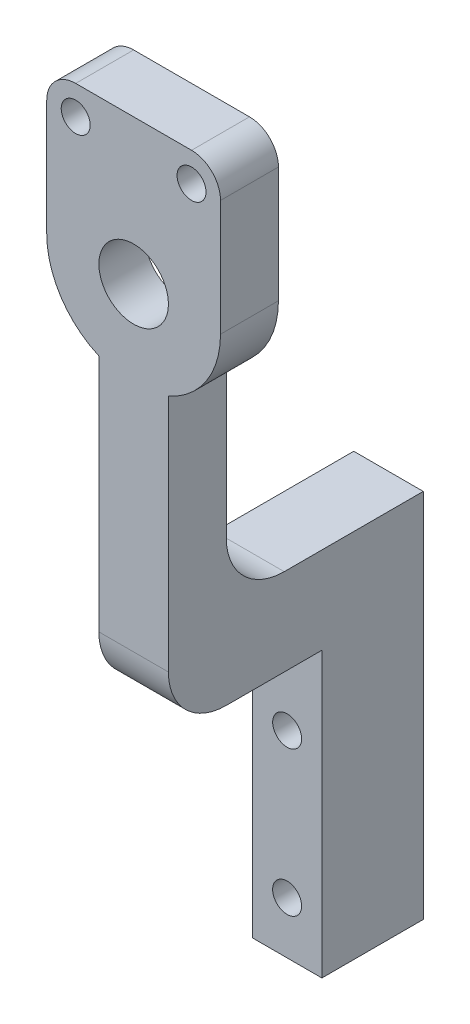
from build123d import *

# Parameters (mm, degrees)
SKETCH_1_R               = 5
EXTRUDE_1_DEPTH          = 12.5
SKETCH_2_R               = 6
EXTRUDE_2_DEPTH          = 22.5
SKETCH_3_R               = 5
EXTRUDE_3_DEPTH          = 12.5
SKETCH_4_W               = 12
SKETCH_4_H               = 35
EXTRUDE_4_DEPTH          = 80
EXTRUDE_5_DEPTH          = 12
EXTRUDE_6_DEPTH          = 10
SKETCH_7_R               = 9.5
CUT_EXTRUDE_1_DEPTH      = 2
SKETCH_8_R               = 6
CUT_EXTRUDE_2_DEPTH      = 166.329973084
EXTRUDE_START            = -10
EXTRUDE_7_DEPTH          = 10
SKETCH_10_R              = 2.5
CUT_EXTRUDE_3_DEPTH      = 10
FILLET_1_R               = 5
FILLET_2_R               = 5
SKETCH_11_R              = 2.5
CUT_EXTRUDE_4_DEPTH      = 10
EXTRUDE_8_DEPTH          = 10
SKETCH_13_R              = 12.5
SKETCH_13_R_2            = 2
CUT_EXTRUDE_5_DEPTH      = 10
PATTERN_CIRCULAR_1_COUNT = 8
SKETCH_14_R              = 2.5
EXTRUDE_9_DEPTH          = 10
SKETCH_15_R              = 2.5
CUT_EXTRUDE_6_DEPTH      = 35
CUT_EXTRUDE_7_DEPTH      = 175.719754648
CUT_EXTRUDE_8_DEPTH      = 1
CUT_EXTRUDE_8_DEPTH_BACK = 162.449682564
SKETCH_18_W              = 84.288718948
SKETCH_18_H              = 107.811152142


with BuildPart() as part:
    # 草图1 → 凸台-拉伸1 (new body)
    with BuildSketch(Plane.XY):
        Circle(SKETCH_1_R)
    extrude(amount=EXTRUDE_1_DEPTH)

    # 草图2 → 凸台-拉伸2 (add)
    with BuildSketch(Plane.XY.offset(12.5)):
        with Locations(Location((0, 0, 0), (0, 0, 180))):
            Circle(SKETCH_2_R)
    extrude_2 = extrude(amount=EXTRUDE_2_DEPTH)

    # 镜向2: 凸台-拉伸2 across plane
    add(extrude_2.mirror(Plane.XY.offset(35)))

    # 草图3 → 凸台-拉伸3 (add)
    with BuildSketch(Plane.XY.offset(57.5)):
        Circle(SKETCH_3_R)
    extrude(amount=EXTRUDE_3_DEPTH)

    # 草图4 → 凸台-拉伸4 (add)
    with BuildSketch(Plane(origin=(0, 0, 0), x_dir=(1, 0, 0), z_dir=(0, 1, 0))):
        with Locations((0, -35)):
            Rectangle(SKETCH_4_W, SKETCH_4_H)
    extrude(amount=EXTRUDE_4_DEPTH)

    # 草图5 → 凸台-拉伸5 (add)
    with BuildSketch(Plane.ZY.offset(6)):
        with BuildLine():
            Line((17.5, 65), (17.5, 80))
            Line((17.5, 80), (13, 80))
            ThreePointArc((13, 80), (5.928932188, 82.928932188), (3, 90))
            Line((3, 90), (3, 130))
            Line((3, 130), (-7, 130))
            Line((-7, 130), (-7, 75))
            ThreePointArc((-7, 75), (-4.071067812, 67.928932188), (3, 65))
            Line((3, 65), (17.5, 65))
        make_face()
        with BuildLine():
            Line((59, 80), (52.5, 80))
            Line((52.5, 80), (52.5, 65))
            Line((52.5, 65), (69, 65))
            ThreePointArc((69, 65), (76.071067812, 67.928932188), (79, 75))
            Line((79, 75), (79, 130))
            Line((79, 130), (69, 130))
            Line((69, 130), (69, 90))
            ThreePointArc((69, 90), (66.071067812, 82.928932188), (59, 80))
        make_face()
    extrude(amount=-EXTRUDE_5_DEPTH)

    # 草图6 → 凸台-拉伸6 (add)
    with BuildSketch(Plane(origin=(0, 0, 69), x_dir=(-1, 0, 0), z_dir=(0, 0, -1))):
        with BuildLine():
            Line((6, 116.252272915), (6, 130))
            Line((6, 130), (-6, 130))
            Line((-6, 130), (-6, 116.252272915))
            ThreePointArc((-6, 116.252272915), (0, 115), (6, 116.252272915))
        make_face()
        with BuildLine():
            Line((-6, 130), (6, 130))
            Line((6, 130), (6, 116.252272915))
            ThreePointArc((6, 116.252272915), (12.549900398, 121.784161637), (15, 130))
            ThreePointArc((15, 130), (-8.215838363, 142.549900398), (-6, 116.252272915))
            Line((-6, 116.252272915), (-6, 130))
        make_face()
    extrude(amount=-EXTRUDE_6_DEPTH)

    # 草图7 → 切除-拉伸1 (cut)
    with BuildSketch(Plane(origin=(0, 0, 69), x_dir=(-1, 0, 0), z_dir=(0, 0, -1))):
        with Locations((0, 130)):
            Circle(SKETCH_7_R)
    extrude(amount=-CUT_EXTRUDE_1_DEPTH, mode=Mode.SUBTRACT)

    # 草图8 → 切除-拉伸2 (cut, through all)
    with BuildSketch(Plane(origin=(0, 0, 71), x_dir=(-1, 0, 0), z_dir=(0, 0, -1))):
        with Locations((0, 130)):
            Circle(SKETCH_8_R)
    extrude(amount=-CUT_EXTRUDE_2_DEPTH, mode=Mode.SUBTRACT)

    # 草图9 → 凸台-拉伸7 (add)
    with BuildSketch(Plane.XY.offset(79).offset(EXTRUDE_START)):
        with BuildLine():
            Line((-15, 155), (-15, 130))
            ThreePointArc((-15, 130), (0, 145), (15, 130))
            Line((15, 130), (15, 155))
            Line((15, 155), (-15, 155))
        make_face()
    extrude(amount=EXTRUDE_7_DEPTH)

    # 草图10 → 切除-拉伸3 (cut)
    with BuildSketch(Plane.XY.offset(79)):
        with Locations((10, 150)):
            Circle(SKETCH_10_R)
    extrude(amount=-CUT_EXTRUDE_3_DEPTH, mode=Mode.SUBTRACT)

    # 圆角1
    fillet_1_edges = [part.edges().sort_by_distance(p)[0] for p in [
        (15, 155, 74),
    ]]
    fillet(fillet_1_edges, radius=FILLET_1_R)

    # 圆角2
    fillet_2_edges = [part.edges().sort_by_distance(p)[0] for p in [
        (-15, 155, 74),
    ]]
    fillet(fillet_2_edges, radius=FILLET_2_R)

    # 草图11 → 切除-拉伸4 (cut)
    with BuildSketch(Plane.XY.offset(79)):
        with Locations((-10, 150)):
            Circle(SKETCH_11_R)
    extrude(amount=-CUT_EXTRUDE_4_DEPTH, mode=Mode.SUBTRACT)

    # 草图12 → 凸台-拉伸8 (add)
    with BuildSketch(Plane.XY.offset(3)):
        with BuildLine():
            ThreePointArc((-6, 103.162526199), (0, 102.5), (6, 103.162526199))
            Line((6, 103.162526199), (6, 130))
            Line((6, 130), (-6, 130))
            Line((-6, 130), (-6, 103.162526199))
        make_face()
        with BuildLine():
            Line((6, 130), (6, 103.162526199))
            ThreePointArc((6, 103.162526199), (21.462176031, 112.806251136), (27.5, 130))
            ThreePointArc((27.5, 130), (-17.193748864, 151.462176031), (-6, 103.162526199))
            Line((-6, 103.162526199), (-6, 130))
            Line((-6, 130), (6, 130))
        make_face()
    extrude(amount=-EXTRUDE_8_DEPTH)

    # 草图13 → 切除-拉伸5 (cut)
    with BuildSketch(Plane(origin=(0, 0, -7), x_dir=(-1, 0, 0), z_dir=(0, 0, -1))):
        with Locations(Location((0, 130, 0), (0, 0, 90))):
            Circle(SKETCH_13_R)
        with Locations(Location((0, 150, 0), (0, 0, 90))):
            Circle(SKETCH_13_R_2)
    cut_extrude_5 = extrude(amount=-CUT_EXTRUDE_5_DEPTH, mode=Mode.SUBTRACT)

    # 阵列(圆周)1: 切除-拉伸5 ×8 about axis
    pattern_circular_1_axis = Axis((0, 130, 0), (0, 0, 1))
    for i in range(1, PATTERN_CIRCULAR_1_COUNT):
        add(cut_extrude_5.rotate(pattern_circular_1_axis, i * 360 / PATTERN_CIRCULAR_1_COUNT), mode=Mode.SUBTRACT)

    # 草图14 → 凸台-拉伸9 (add)
    with BuildSketch(Plane(origin=(0, 0, -7), x_dir=(-1, 0, 0), z_dir=(0, 0, -1)).offset(EXTRUDE_START)):
        with BuildLine():
            Line((-6, 161.837473801), (-6, 156.837473801))
            ThreePointArc((-6, 156.837473801), (0, 157.5), (6, 156.837473801))
            Line((6, 156.837473801), (6, 161.837473801))
            ThreePointArc((6, 161.837473801), (4.535533906, 165.373007707), (1, 166.837473801))
            Line((1, 166.837473801), (-1, 166.837473801))
            ThreePointArc((-1, 166.837473801), (-4.535533906, 165.373007707), (-6, 161.837473801))
        make_face()
        with Locations(Location((0, 161.837473801, 0), (0, 0, 90))):
            Circle(SKETCH_14_R, mode=Mode.SUBTRACT)
    extrude(amount=EXTRUDE_9_DEPTH)

    # 草图15 → 切除-拉伸6 (cut)
    with BuildSketch(Plane(origin=(0, 0, 17.5), x_dir=(-1, 0, 0), z_dir=(0, 0, -1))):
        with Locations((0, 25)):
            Circle(SKETCH_15_R)
        with Locations((0, 50)):
            Circle(SKETCH_15_R)
    extrude(amount=-CUT_EXTRUDE_6_DEPTH, mode=Mode.SUBTRACT)

    # 草图16 → 切除-拉伸7 (cut, through all)
    with BuildSketch(Plane.XY.offset(35)):
        Polygon((-6, 97.653254631), (-6, 65), (-6, 15), (6, 15), (6, 65), (6, 97.653254631), align=None)
    extrude(amount=-CUT_EXTRUDE_7_DEPTH, mode=Mode.SUBTRACT)


with BuildPart() as cut_extrude_7_kept_piece:
    # of the separate pieces the step leaves, the one the design keeps (cut_extrude_7_pieces_kept)
    add(part.part.solids().sort_by_distance((-10, 155, 69))[0])

    # 草图18 → 切除-拉伸8 (cut, two sides: drawn at the far end of the back side and taken through both)
    with BuildSketch(Plane(origin=(0, 15, 0), x_dir=(1, 0, 0), z_dir=(0, 1, 0)).offset(-CUT_EXTRUDE_8_DEPTH_BACK)):
        with Locations((0, -29.971236553)):
            Rectangle(SKETCH_18_W, SKETCH_18_H)
    extrude(amount=CUT_EXTRUDE_8_DEPTH + CUT_EXTRUDE_8_DEPTH_BACK, mode=Mode.SUBTRACT)


solid = cut_extrude_7_kept_piece.part
